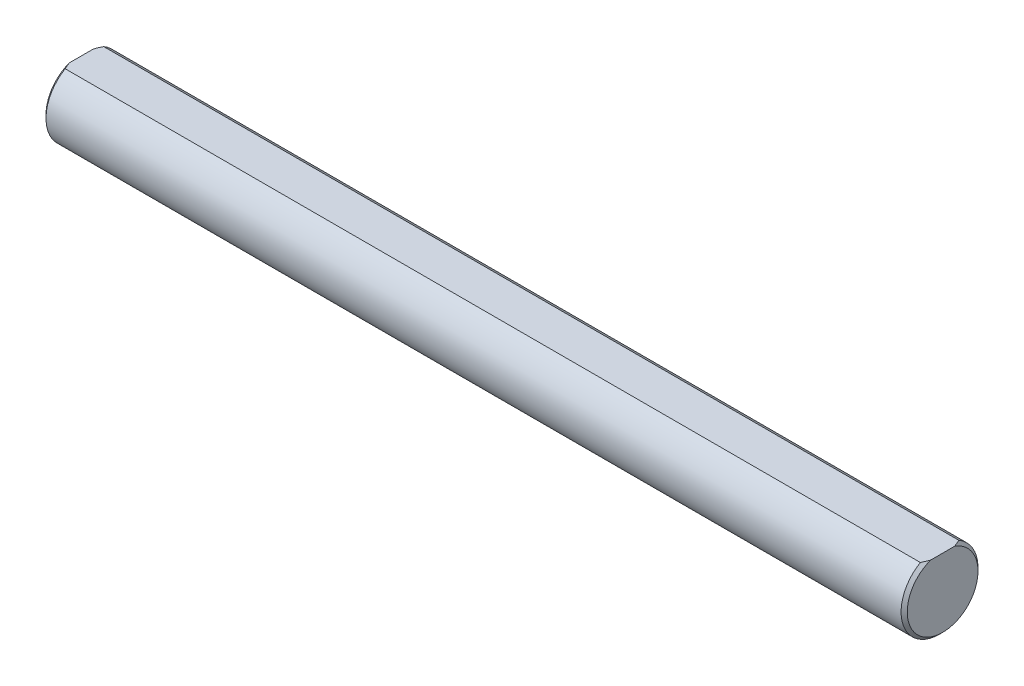
from build123d import *

# Parameters (mm, degrees)
SKETCH1_R           = 3.175
BOSS_EXTRUDE1_DEPTH = 71.12
CHAMFER1_SIZE       = 0.254
CUT_EXTRUDE2_DEPTH  = 72.261600108


with BuildPart() as part:
    # Sketch1 → Boss-Extrude1 (new body)
    with BuildSketch(Plane(origin=(0, 0, 0), x_dir=(0, 0, -1), z_dir=(1, 0, 0))):
        Circle(SKETCH1_R)
    extrude(amount=BOSS_EXTRUDE1_DEPTH)

    # Chamfer1
    chamfer1_edges = [part.edges().sort_by_distance(p)[0] for p in [
        (0, 0, 3.175),
        (71.12, 0, 3.175),
    ]]
    chamfer(chamfer1_edges, length=CHAMFER1_SIZE)

    # Sketch2 → Cut-Extrude2 (cut, through all)
    with BuildSketch(Plane(origin=(71.12, 0, 0), x_dir=(0, 0, -1), z_dir=(1, 0, 0))):
        with BuildLine():
            Line((-1.5875, 2.749630657), (1.5875, 2.749630657))
            ThreePointArc((1.5875, 2.749630657), (0, 3.175), (-1.5875, 2.749630657))
        make_face()
    extrude(amount=-CUT_EXTRUDE2_DEPTH, mode=Mode.SUBTRACT)


solid = part.part
